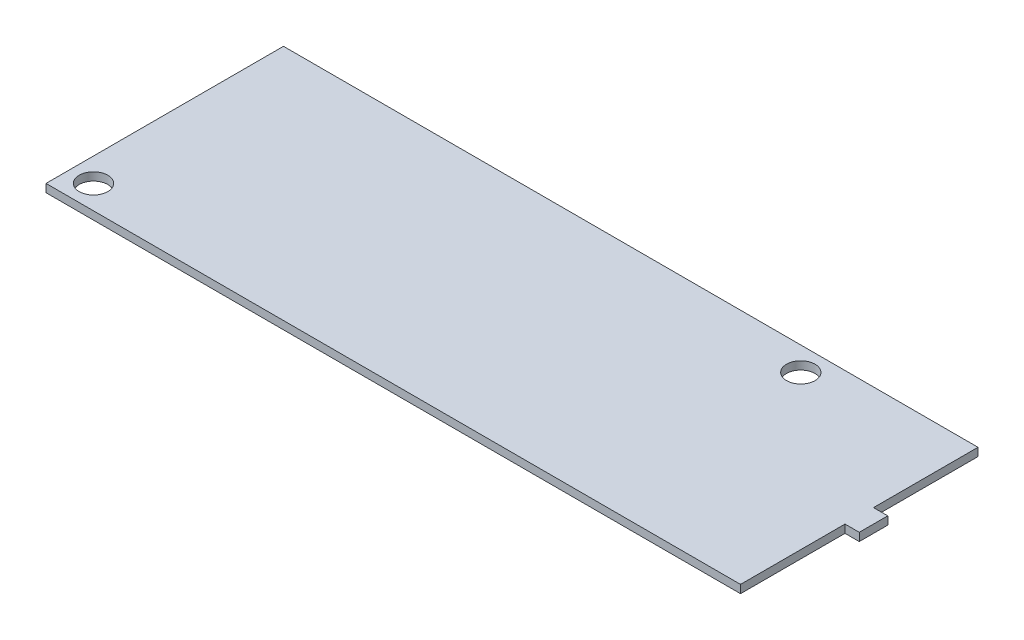
from build123d import *

# Parameters (mm, degrees)
CROQUIS1_R              = 3
SALIENTE_EXTRUIR1_DEPTH = 1.7


with BuildPart() as part:
    # Croquis1 → Saliente-Extruir1 (new body)
    with BuildSketch(Plane(origin=(0, 0, 0), x_dir=(1, 0, 0), z_dir=(0, 1, 0))):
        Polygon((74.6125, -3), (71.6125, -3), (71.6125, -25), (-74.6125, -25), (-74.6125, 25), (71.6125, 25), (71.6125, 3), (74.6125, 3), align=None)
        with Locations(Location((39.306, 20, 0), (0, 0, 270))):
            Circle(CROQUIS1_R, mode=Mode.SUBTRACT)
        with Locations(Location((-69.6125, -20, 0), (0, 0, 270))):
            Circle(CROQUIS1_R, mode=Mode.SUBTRACT)
    extrude(amount=SALIENTE_EXTRUIR1_DEPTH)


solid = part.part
